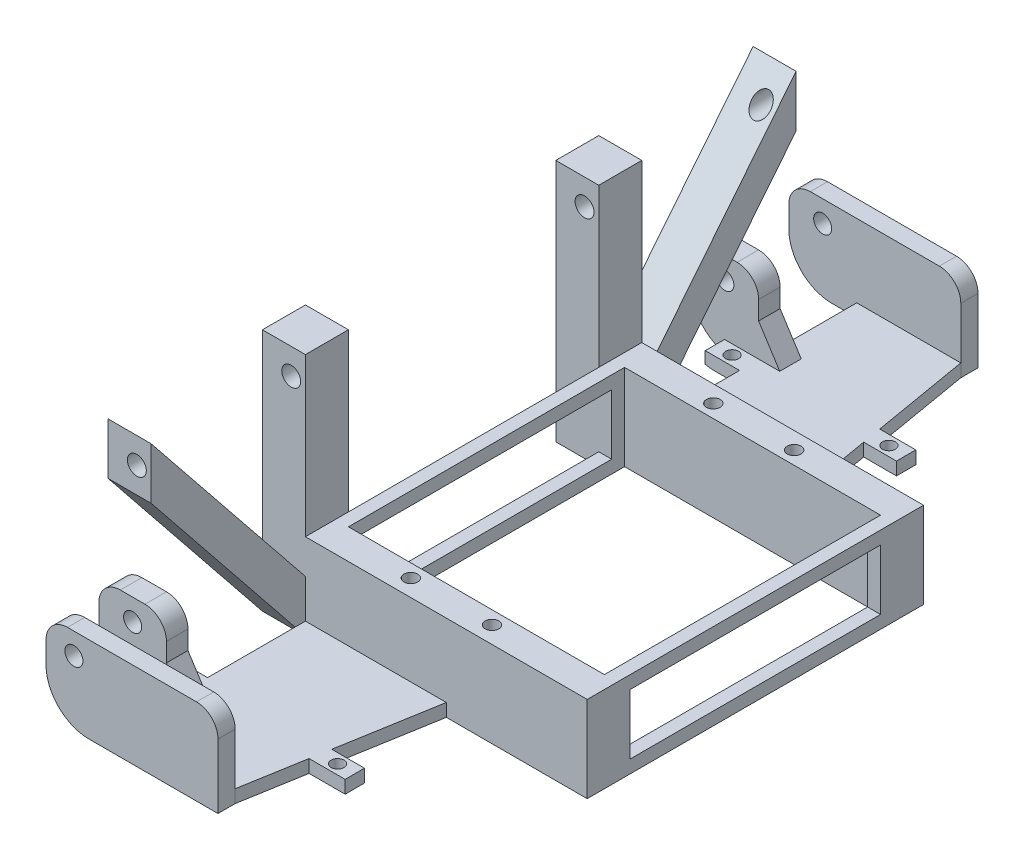
from build123d import *

# Parameters (mm, degrees)
SKETCH1_R            = 1.6
SKETCH1_R_2          = 1.599939077
SKETCH1_W            = 59.532
SKETCH1_H            = 64.229021166
SKETCH1_R_3          = 1.599995589
SKETCH1_R_4          = 1.5
BOSS_EXTRUDE1_DEPTH  = 3
SKETCH2_W            = 40
SKETCH2_H            = 4
BOSS_EXTRUDE2_DEPTH  = 20
FILLET2_R            = 5
FILLET3_R            = 10
SKETCH1_8_W          = 65.532
SKETCH1_8_H          = 78.229021166
SKETCH1_8_R          = 1.599939077
SKETCH1_8_R_2        = 1.6
SKETCH1_8_R_3        = 1.599995589
SKETCH1_8_W_2        = 59.532
SKETCH1_8_H_2        = 64.229021166
BOSS_EXTRUDE3_DEPTH  = 20
SKETCH5_R            = 2.5
CUT_EXTRUDE2_DEPTH   = 5
SKETCH7_W            = 58.229021166
SKETCH7_H            = 14
CUT_EXTRUDE3_DEPTH   = 116.606034034
SKETCH8_R            = 2.1
CUT_EXTRUDE4_DEPTH   = 211
FILLET4_R            = 10
FILLET5_R            = 5
SKETCH9_W            = 10
SKETCH9_H            = 56.69
BOSS_EXTRUDE4_DEPTH  = 10
BOSS_EXTRUDE5_DEPTH  = 10
BOSS_EXTRUDE6_DEPTH  = 5
FILLET6_R            = 5
FILLET7_R            = 10
SKETCH10_R           = 2.2
CUT_EXTRUDE5_DEPTH   = 152.400246686
SKETCH13_R           = 2.1
CUT_EXTRUDE6_DEPTH   = 199.107125443
SKETCH17_R           = 2.1
CUT_EXTRUDE7_DEPTH   = 175.444467791
FILLET6_OF_MIRROR1_R = 5
FILLET7_OF_MIRROR1_R = 10


with BuildPart() as part:
    # Sketch1 → Boss-Extrude1 (new body)
    with BuildSketch(Plane(origin=(0, 0, 0), x_dir=(1, 0, 0), z_dir=(0, 1, 0))):
        Polygon((65.532, 39.114510583), (32.766, 39.114510583), (28.86847, 61.864510583), (36.483, 61.864510583), (36.483, 66.364510583), (28.09753, 66.364510583), (24.2, 89.114510583), (0, 89.114510583), (0, 66.364510583), (-8, 66.364510583), (-8, 61.864510583), (0, 61.864510583), (0, -61.864510583), (-8, -61.864510583), (-8, -66.364510583), (0, -66.364510583), (0, -81.031073521), (25.584854437, -81.031073521), (28.09753, -66.364510583), (36.483, -66.364510583), (36.483, -61.864510583), (28.86847, -61.864510583), (32.766, -39.114510583), (65.532, -39.114510583), align=None)
        with Locations(Location((20.574, -35.179510583, 0), (0, 0, 270))):
            Circle(SKETCH1_R, mode=Mode.SUBTRACT)
        with Locations(Location((39.450944, -35.179510583, 0), (0, 0, 270))):
            Circle(SKETCH1_R_2, mode=Mode.SUBTRACT)
        with Locations((32.766, 0)):
            Rectangle(SKETCH1_W, SKETCH1_H, mode=Mode.SUBTRACT)
        with Locations(Location((20.574, 35.1758104, 0), (0, 0, 270))):
            Circle(SKETCH1_R_3, mode=Mode.SUBTRACT)
        with Locations(Location((39.37, 35.1758104, 0), (0, 0, 270))):
            Circle(SKETCH1_R_2, mode=Mode.SUBTRACT)
        with Locations(Location((-4, 64.114510583, 0), (0, 0, 270))):
            Circle(SKETCH1_R_4, mode=Mode.SUBTRACT)
        with Locations(Location((-4, -64.114510583, 0), (0, 0, 270))):
            Circle(SKETCH1_R_4, mode=Mode.SUBTRACT)
        with Locations(Location((32.483, 64.114510583, 0), (0, 0, 270))):
            Circle(SKETCH1_R_4, mode=Mode.SUBTRACT)
        with Locations(Location((32.483, -64.114510583, 0), (0, 0, 270))):
            Circle(SKETCH1_R_4, mode=Mode.SUBTRACT)
    extrude(amount=BOSS_EXTRUDE1_DEPTH)

    # Sketch2 → Boss-Extrude2 (add)
    with BuildSketch(Plane(origin=(0, 0, 0), x_dir=(1, 0, 0), z_dir=(0, 1, 0))):
        with Locations((5.584854437, -83.037326961)):
            Rectangle(SKETCH2_W, SKETCH2_H)
        with Locations((4.2, 91.114510583)):
            Rectangle(SKETCH2_W, SKETCH2_H)
    extrude(amount=BOSS_EXTRUDE2_DEPTH)


with BuildPart() as boss_extrude2_piece_1:
    # of the separate pieces the step leaves, piece 1, a body of its own (boss_extrude2_pieces)
    add(part.part.solids().sort_by_distance((65.532, 0, -39.114510583))[0])

    # Sketch1<8> → Boss-Extrude3 (add)
    with BuildSketch(Plane(origin=(0, 0, 0), x_dir=(1, 0, 0), z_dir=(0, 1, 0))):
        with Locations((32.766, 0)):
            Rectangle(SKETCH1_8_W, SKETCH1_8_H)
        with Locations(Location((39.450944, -35.179510583, 0), (0, 0, 270))):
            Circle(SKETCH1_8_R, mode=Mode.SUBTRACT)
        with Locations(Location((20.574, -35.179510583, 0), (0, 0, 270))):
            Circle(SKETCH1_8_R_2, mode=Mode.SUBTRACT)
        with Locations(Location((39.37, 35.1758104, 0), (0, 0, 270))):
            Circle(SKETCH1_8_R, mode=Mode.SUBTRACT)
        with Locations(Location((20.574, 35.1758104, 0), (0, 0, 270))):
            Circle(SKETCH1_8_R_3, mode=Mode.SUBTRACT)
        with Locations((32.766, 0)):
            Rectangle(SKETCH1_8_W_2, SKETCH1_8_H_2, mode=Mode.SUBTRACT)
    extrude(amount=BOSS_EXTRUDE3_DEPTH)

    # Sketch5 → Cut-Extrude2 (cut)
    with BuildSketch(Plane(origin=(0, 0, 0), x_dir=(1, 0, 0), z_dir=(0, 1, 0))):
        with Locations(Location((20.574, -35.179510583, 0), (0, 0, 270))):
            Circle(SKETCH5_R)
        with Locations(Location((39.450944, -35.179510583, 0), (0, 0, 270))):
            Circle(SKETCH5_R)
        with Locations(Location((20.574, 35.1758104, 0), (0, 0, 270))):
            Circle(SKETCH5_R)
        with Locations(Location((39.37, 35.1758104, 0), (0, 0, 270))):
            Circle(SKETCH5_R)
    extrude(amount=CUT_EXTRUDE2_DEPTH, mode=Mode.SUBTRACT)

    # Sketch7 → Cut-Extrude3 (cut, through all)
    with BuildSketch(Plane(origin=(0, 0, 0), x_dir=(0, 0, -1), z_dir=(1, 0, 0))):
        with Locations((0, 10)):
            Rectangle(SKETCH7_W, SKETCH7_H)
    extrude(amount=CUT_EXTRUDE3_DEPTH, mode=Mode.SUBTRACT)

    # Sketch8 → Cut-Extrude4 (cut)
    with BuildSketch(Plane(origin=(0, 0, -93.114510583), x_dir=(-1, 0, 0), z_dir=(0, 0, -1))):
        with Locations((7.931565672, 15)):
            Circle(SKETCH8_R)
    extrude(amount=-CUT_EXTRUDE4_DEPTH, mode=Mode.SUBTRACT)

    # Fillet4
    fillet4_edges = [boss_extrude2_piece_1.edges().sort_by_distance(p)[0] for p in [
        (-15.8, 0, -91.114510583),
    ]]
    fillet(fillet4_edges, radius=FILLET4_R)

    # Fillet5
    fillet5_edges = [boss_extrude2_piece_1.edges().sort_by_distance(p)[0] for p in [
        (24.2, 20, -91.114510583),
        (-15.8, 20, -91.114510583),
    ]]
    fillet(fillet5_edges, radius=FILLET5_R)

    # Sketch9 → Boss-Extrude4 (add)
    with BuildSketch(Plane.ZY):
        with Locations((-34.114510583, 28.345)):
            Rectangle(SKETCH9_W, SKETCH9_H)
    boss_extrude4 = extrude(amount=BOSS_EXTRUDE4_DEPTH)

    # Sketch11 → Boss-Extrude5 (add)
    with BuildSketch(Plane.ZY.offset(10)):
        Polygon((-39.114510583, 0), (-75.010587766, 44.691383006), (-75.010587766, 56.691383006), (-39.114510583, 12), align=None)
    boss_extrude5 = extrude(amount=-BOSS_EXTRUDE5_DEPTH)

    # Sketch15 → Boss-Extrude6 (add)
    with BuildSketch(Plane(origin=(0, 0, -66.364510583), x_dir=(-1, 0, 0), z_dir=(0, 0, -1))):
        Polygon((15.8, 0), (0, 0), (0, 3), (-4.838584017, 3), (0.074385319, 10.680797484), (0.074385319, 20), (15.8, 20), align=None)
    boss_extrude6 = extrude(amount=BOSS_EXTRUDE6_DEPTH)

    # Fillet6
    fillet6_edges = [boss_extrude2_piece_1.edges().sort_by_distance(p)[0] for p in [
        (-15.8, 20, -68.864510583),
        (-0.074385319, 20, -68.864510583),
    ]]
    fillet(fillet6_edges, radius=FILLET6_R)

    # Fillet7
    fillet7_edges = [boss_extrude2_piece_1.edges().sort_by_distance(p)[0] for p in [
        (-15.8, 0, -68.864510583),
    ]]
    fillet(fillet7_edges, radius=FILLET7_R)

    # Sketch10 → Cut-Extrude5 (cut, symmetric)
    with BuildSketch(Plane(origin=(0, 0, -39.114510583), x_dir=(-1, 0, 0), z_dir=(0, 0, -1))):
        with Locations((3.311588347, 50.691383006)):
            Circle(SKETCH10_R)
    cut_extrude5 = extrude(amount=CUT_EXTRUDE5_DEPTH, both=True, mode=Mode.SUBTRACT)

    # Sketch17 → Cut-Extrude7 (cut, through all)
    with BuildSketch(Plane.XY.offset(-66.364510583)):
        with Locations((-7.931565672, 15)):
            Circle(SKETCH17_R)
    cut_extrude7 = extrude(amount=-CUT_EXTRUDE7_DEPTH, mode=Mode.SUBTRACT)

    # Mirror1: Boss-Extrude4, Boss-Extrude5, Boss-Extrude6 across plane
    add(boss_extrude4.mirror(Plane.XY))
    add(boss_extrude5.mirror(Plane.XY))
    add(boss_extrude6.mirror(Plane.XY))

    # Mirror1 2: Cut-Extrude5, Cut-Extrude7 across plane
    add(cut_extrude5.mirror(Plane.XY), mode=Mode.SUBTRACT)
    add(cut_extrude7.mirror(Plane.XY), mode=Mode.SUBTRACT)

    # Fillet6 of Mirror1
    fillet6_of_mirror1_edges = [boss_extrude2_piece_1.edges().sort_by_distance(p)[0] for p in [
        (-15.8, 20, 68.864510583),
        (-0.074385319, 20, 68.864510583),
    ]]
    fillet(fillet6_of_mirror1_edges, radius=FILLET6_OF_MIRROR1_R)

    # Fillet7 of Mirror1
    fillet7_of_mirror1_edges = [boss_extrude2_piece_1.edges().sort_by_distance(p)[0] for p in [
        (-15.8, 0, 68.864510583),
    ]]
    fillet(fillet7_of_mirror1_edges, radius=FILLET7_OF_MIRROR1_R)


with BuildPart() as boss_extrude2_piece_2:
    # of the separate pieces the step leaves, piece 2, a body of its own (boss_extrude2_pieces)
    add(part.part.solids().sort_by_distance((25.584854437, 0, 81.037326961))[0])

    # Fillet2
    fillet2_edges = [boss_extrude2_piece_2.edges().sort_by_distance(p)[0] for p in [
        (25.584854437, 20, 83.037326961),
        (-14.415145563, 20, 83.037326961),
    ]]
    fillet(fillet2_edges, radius=FILLET2_R)

    # Fillet3
    fillet3_edges = [boss_extrude2_piece_2.edges().sort_by_distance(p)[0] for p in [
        (-14.415145563, 0, 83.037326961),
    ]]
    fillet(fillet3_edges, radius=FILLET3_R)

    # Sketch13 → Cut-Extrude6 (cut, through all)
    with BuildSketch(Plane.XY.offset(85.037326961)):
        with Locations((-7.931565672, 15)):
            Circle(SKETCH13_R)
    extrude(amount=-CUT_EXTRUDE6_DEPTH, mode=Mode.SUBTRACT)


solid = Compound([boss_extrude2_piece_1.part, boss_extrude2_piece_2.part])
